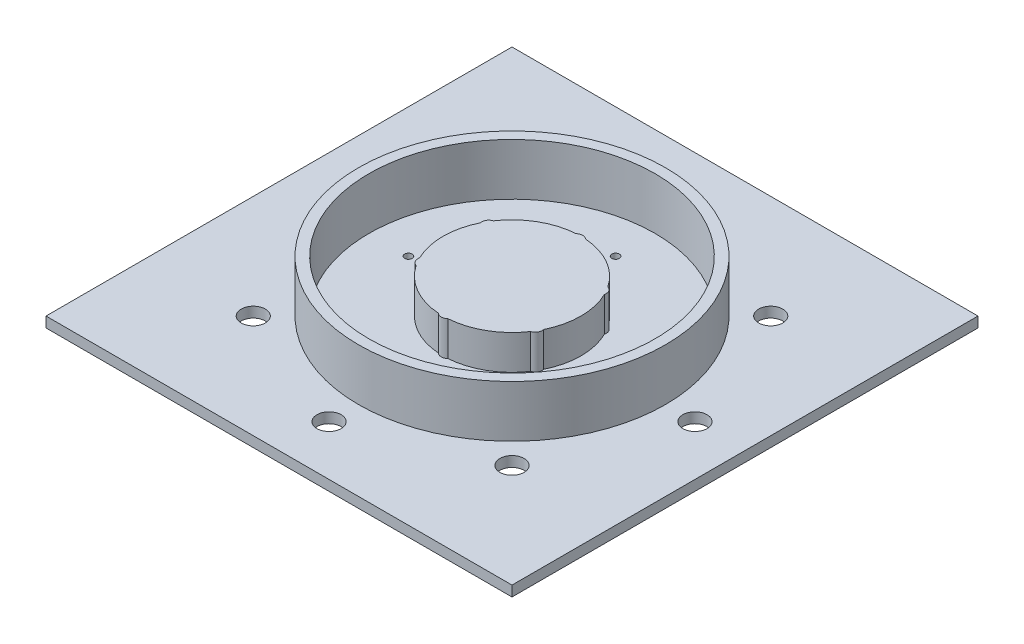
from build123d import *

# Parameters (mm, degrees)
SKETCH1_W               = 135
SKETCH1_H               = 135
BOSS_EXTRUDE1_DEPTH     = 3
BOSS_EXTRUDE2_DEPTH     = 10
SKETCH3_R               = 44.45
SKETCH3_R_2             = 41.45
BOSS_EXTRUDE3_DEPTH     = 15
CUT_EXTRUDE1_DEPTH      = 192.507180022
CUT_EXTRUDE1_DEPTH_BACK = 192.507180022
SKETCH4_R               = 1.1
CUT_EXTRUDE2_DEPTH      = 192.507180022
CUT_EXTRUDE2_DEPTH_BACK = 192.507180022
SKETCH5_R               = 3.5


with BuildPart() as part:
    # Sketch1 → Boss-Extrude1 (new body)
    with BuildSketch(Plane(origin=(0, 0, 0), x_dir=(1, 0, 0), z_dir=(0, 1, 0))):
        with Locations((67.5, 67.5)):
            Rectangle(SKETCH1_W, SKETCH1_H)
    extrude(amount=BOSS_EXTRUDE1_DEPTH)

    # Sketch2 → Boss-Extrude2 (add)
    with BuildSketch(Plane(origin=(0, 3, 0), x_dir=(1, 0, 0), z_dir=(0, 1, 0))):
        with BuildLine():
            ThreePointArc((50.907776173, 56.333169273), (52.06098052, 54.786358606), (53.357864376, 53.357864376))
            Line((53.357864376, 53.357864376), (81.642135624, 81.642135624))
            ThreePointArc((81.642135624, 81.642135624), (75.784522289, 85.703480174), (68.874647176, 87.452702703))
            ThreePointArc((68.874647176, 87.452702703), (67.5, 87.5), (66.125352824, 87.452702703))
            ThreePointArc((66.125352824, 87.452702703), (57.5, 84.820508076), (50.907776173, 78.666830727))
            ThreePointArc((50.907776173, 78.666830727), (50.179491924, 77.5), (49.533128997, 76.285871976))
            ThreePointArc((49.533128997, 76.285871976), (47.5, 67.5), (49.533128997, 58.714128024))
            ThreePointArc((49.533128997, 58.714128024), (50.179491924, 57.5), (50.907776173, 56.333169273))
        make_face()
        with BuildLine():
            Line((81.642135624, 81.642135624), (53.357864376, 53.357864376))
            ThreePointArc((53.357864376, 53.357864376), (59.215477711, 49.296519826), (66.125352824, 47.547297297))
            ThreePointArc((66.125352824, 47.547297297), (67.5, 47.5), (68.874647176, 47.547297297))
            ThreePointArc((68.874647176, 47.547297297), (77.5, 50.179491924), (84.092223827, 56.333169273))
            ThreePointArc((84.092223827, 56.333169273), (84.820508076, 57.5), (85.466871003, 58.714128024))
            ThreePointArc((85.466871003, 58.714128024), (86.985089428, 62.990976827), (87.5, 67.5))
            ThreePointArc((87.5, 67.5), (86.985089428, 72.009023173), (85.466871003, 76.285871976))
            ThreePointArc((85.466871003, 76.285871976), (84.820508076, 77.5), (84.092223827, 78.666830727))
            ThreePointArc((84.092223827, 78.666830727), (82.93901948, 80.213641394), (81.642135624, 81.642135624))
        make_face()
        with BuildLine():
            ThreePointArc((66.125352824, 87.452702703), (67.5, 87.5), (68.874647176, 87.452702703))
            ThreePointArc((68.874647176, 87.452702703), (67.5, 88), (66.125352824, 87.452702703))
        make_face()
        with BuildLine():
            ThreePointArc((68.874647176, 47.547297297), (67.5, 47), (66.125352824, 47.547297297))
            ThreePointArc((66.125352824, 47.547297297), (67.5, 47.5), (68.874647176, 47.547297297))
        make_face()
        with BuildLine():
            ThreePointArc((50.907776173, 56.333169273), (49.746479222, 57.25), (49.533128997, 58.714128024))
            ThreePointArc((49.533128997, 58.714128024), (50.179491924, 57.5), (50.907776173, 56.333169273))
        make_face()
        with BuildLine():
            ThreePointArc((85.466871003, 58.714128024), (85.253520778, 57.25), (84.092223827, 56.333169273))
            ThreePointArc((84.092223827, 56.333169273), (84.820508076, 57.5), (85.466871003, 58.714128024))
        make_face()
        with BuildLine():
            ThreePointArc((84.092223827, 78.666830727), (85.253520778, 77.75), (85.466871003, 76.285871976))
            ThreePointArc((85.466871003, 76.285871976), (84.820508076, 77.5), (84.092223827, 78.666830727))
        make_face()
        with BuildLine():
            ThreePointArc((49.533128997, 76.285871976), (49.746479222, 77.75), (50.907776173, 78.666830727))
            ThreePointArc((50.907776173, 78.666830727), (50.179491924, 77.5), (49.533128997, 76.285871976))
        make_face()
    extrude(amount=BOSS_EXTRUDE2_DEPTH)

    # Sketch3 → Boss-Extrude3 (add)
    with BuildSketch(Plane(origin=(0, 3, 0), x_dir=(1, 0, 0), z_dir=(0, 1, 0))):
        with Locations(Location((67.5, 67.5, 0), (0, 0, 90))):
            Circle(SKETCH3_R)
        with Locations(Location((67.5, 67.5, 0), (0, 0, 270))):
            Circle(SKETCH3_R_2, mode=Mode.SUBTRACT)
    extrude(amount=BOSS_EXTRUDE3_DEPTH)

    # Sketch4 → Cut-Extrude1 (cut, two sides: drawn at the far end of the back side and taken through both)
    with BuildSketch(Plane(origin=(0, 3, 0), x_dir=(1, 0, 0), z_dir=(0, 1, 0)).offset(-CUT_EXTRUDE1_DEPTH_BACK)):
        with Locations(Location((67.5, 97.5, 0), (0, 0, 270))):
            Circle(SKETCH4_R)
        with Locations(Location((97.5, 67.5, 0), (0, 0, 270))):
            Circle(SKETCH4_R)
        with Locations(Location((67.5, 37.5, 0), (0, 0, 270))):
            Circle(SKETCH4_R)
        with Locations(Location((37.5, 67.5, 0), (0, 0, 270))):
            Circle(SKETCH4_R)
    extrude(amount=CUT_EXTRUDE1_DEPTH + CUT_EXTRUDE1_DEPTH_BACK, mode=Mode.SUBTRACT)

    # Sketch5 → Cut-Extrude2 (cut, two sides: drawn at the far end of the back side and taken through both)
    with BuildSketch(Plane(origin=(0, 3, 0), x_dir=(1, 0, 0), z_dir=(0, 1, 0)).offset(-CUT_EXTRUDE2_DEPTH_BACK)):
        with Locations(Location((67.5, 120.5, 0), (0, 0, 270))):
            Circle(SKETCH5_R)
        with Locations(Location((104.976659403, 104.976659403, 0), (0, 0, 270))):
            Circle(SKETCH5_R)
        with Locations(Location((120.5, 67.5, 0), (0, 0, 270))):
            Circle(SKETCH5_R)
        with Locations(Location((104.976659403, 30.023340597, 0), (0, 0, 270))):
            Circle(SKETCH5_R)
        with Locations(Location((67.5, 14.5, 0), (0, 0, 270))):
            Circle(SKETCH5_R)
        with Locations(Location((30.023340597, 30.023340597, 0), (0, 0, 270))):
            Circle(SKETCH5_R)
        with Locations(Location((14.5, 67.5, 0), (0, 0, 270))):
            Circle(SKETCH5_R)
        with Locations(Location((30.023340597, 104.976659403, 0), (0, 0, 270))):
            Circle(SKETCH5_R)
    extrude(amount=CUT_EXTRUDE2_DEPTH + CUT_EXTRUDE2_DEPTH_BACK, mode=Mode.SUBTRACT)


solid = part.part
